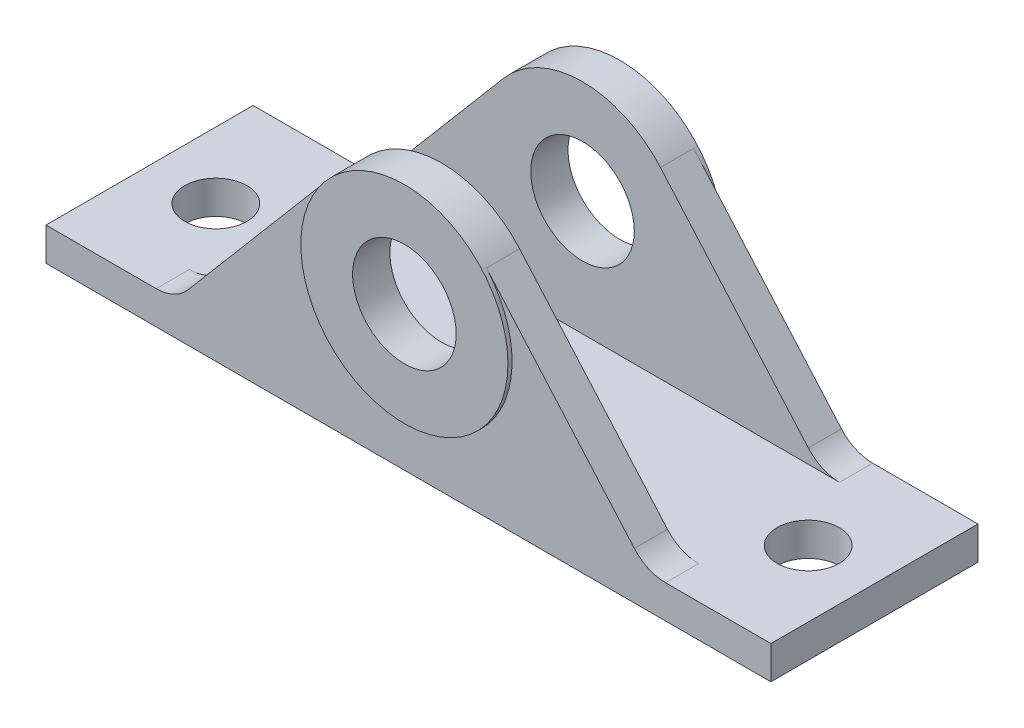
from build123d import *

# Parameters (mm, degrees)
BOSS_EXTRUDE1_DEPTH     = 50
BOSS_EXTRUDE3_DEPTH     = 8
BOSS_EXTRUDE4_START     = 42
BOSS_EXTRUDE4_DEPTH     = 8
BOSS_EXTRUDE5_START     = -1
SKETCH1_6_R             = 25
SKETCH1_6_R_2           = 12.5
BOSS_EXTRUDE5_DEPTH     = 9
BOSS_EXTRUDE7_START     = 42
SKETCH1_8_R             = 25
BOSS_EXTRUDE7_DEPTH     = 9
CUT_EXTRUDE1_DEPTH      = 193.132564476
CUT_EXTRUDE1_DEPTH_BACK = 193.132564476
SKETCH1_10_R            = 12.5
CUT_EXTRUDE2_DEPTH      = 190.755469869
CUT_EXTRUDE2_DEPTH_BACK = 190.755469869
SKETCH2_R               = 7.5


with BuildPart() as part:
    # Sketch1 → Boss-Extrude1 (new body)
    with BuildSketch(Plane.XY):
        Polygon((26.59102299, 8), (149.554580342, 8), (175, 8), (175, 0), (0, 0), (0, 8), align=None)
    extrude(amount=BOSS_EXTRUDE1_DEPTH)

    # Sketch1<4> → Boss-Extrude3 (add)
    with BuildSketch(Plane.XY):
        with BuildLine():
            ThreePointArc((34.21809324, 11.532558512), (30.793735514, 8.926014798), (26.59102299, 8))
            Line((26.59102299, 8), (149.554580342, 8))
            ThreePointArc((149.554580342, 8), (145.422937943, 8.893434726), (142.029566102, 11.414093784))
            Line((142.029566102, 11.414093784), (106.332559555, 52.201264717))
            ThreePointArc((106.332559555, 52.201264717), (110.922089996, 44.531003426), (112.520023955, 35.736499176))
            ThreePointArc((112.520023955, 35.736499176), (78.908749097, 12.266391692), (68.45234833, 51.905102896))
            Line((68.45234833, 51.905102896), (34.21809324, 11.532558512))
        make_face()
    extrude(amount=BOSS_EXTRUDE3_DEPTH)

    # Sketch1<5> → Boss-Extrude4 (add)
    with BuildSketch(Plane.XY.offset(BOSS_EXTRUDE4_START)):
        with BuildLine():
            ThreePointArc((34.21809324, 11.532558512), (30.793735514, 8.926014798), (26.59102299, 8))
            Line((26.59102299, 8), (149.554580342, 8))
            ThreePointArc((149.554580342, 8), (145.422937943, 8.893434726), (142.029566102, 11.414093784))
            Line((142.029566102, 11.414093784), (106.332559555, 52.201264717))
            ThreePointArc((106.332559555, 52.201264717), (110.922089996, 44.531003426), (112.520023955, 35.736499176))
            ThreePointArc((112.520023955, 35.736499176), (78.908749097, 12.266391692), (68.45234833, 51.905102896))
            Line((68.45234833, 51.905102896), (34.21809324, 11.532558512))
        make_face()
    extrude(amount=BOSS_EXTRUDE4_DEPTH)

    # Sketch1<6> → Boss-Extrude5 (add)
    with BuildSketch(Plane.XY.offset(BOSS_EXTRUDE5_START)):
        with Locations((87.520023955, 35.736499176)):
            Circle(SKETCH1_6_R)
        with Locations((87.520023955, 35.736499176)):
            Circle(SKETCH1_6_R_2, mode=Mode.SUBTRACT)
    extrude(amount=BOSS_EXTRUDE5_DEPTH)

    # Sketch1<8> → Boss-Extrude7 (add)
    with BuildSketch(Plane.XY.offset(BOSS_EXTRUDE7_START)):
        with Locations((87.520023955, 35.736499176)):
            Circle(SKETCH1_8_R)
    extrude(amount=BOSS_EXTRUDE7_DEPTH)

    # Sketch1<10> → Cut-Extrude1 (cut, two sides: drawn at the far end of the back side and taken through both)
    with BuildSketch(Plane.XY.offset(-CUT_EXTRUDE1_DEPTH_BACK)):
        with Locations((87.520023955, 35.736499176)):
            Circle(SKETCH1_10_R)
    extrude(amount=CUT_EXTRUDE1_DEPTH + CUT_EXTRUDE1_DEPTH_BACK, mode=Mode.SUBTRACT)

    # Sketch2 → Cut-Extrude2 (cut, two sides: drawn at the far end of the back side and taken through both)
    with BuildSketch(Plane(origin=(0, 8, 0), x_dir=(1, 0, 0), z_dir=(0, 1, 0)).offset(-CUT_EXTRUDE2_DEPTH_BACK)):
        with Locations(Location((16, -25, 0), (0, 0, 270))):
            Circle(SKETCH2_R)
        with Locations(Location((159, -25, 0), (0, 0, 270))):
            Circle(SKETCH2_R)
    extrude(amount=CUT_EXTRUDE2_DEPTH + CUT_EXTRUDE2_DEPTH_BACK, mode=Mode.SUBTRACT)


solid = part.part
